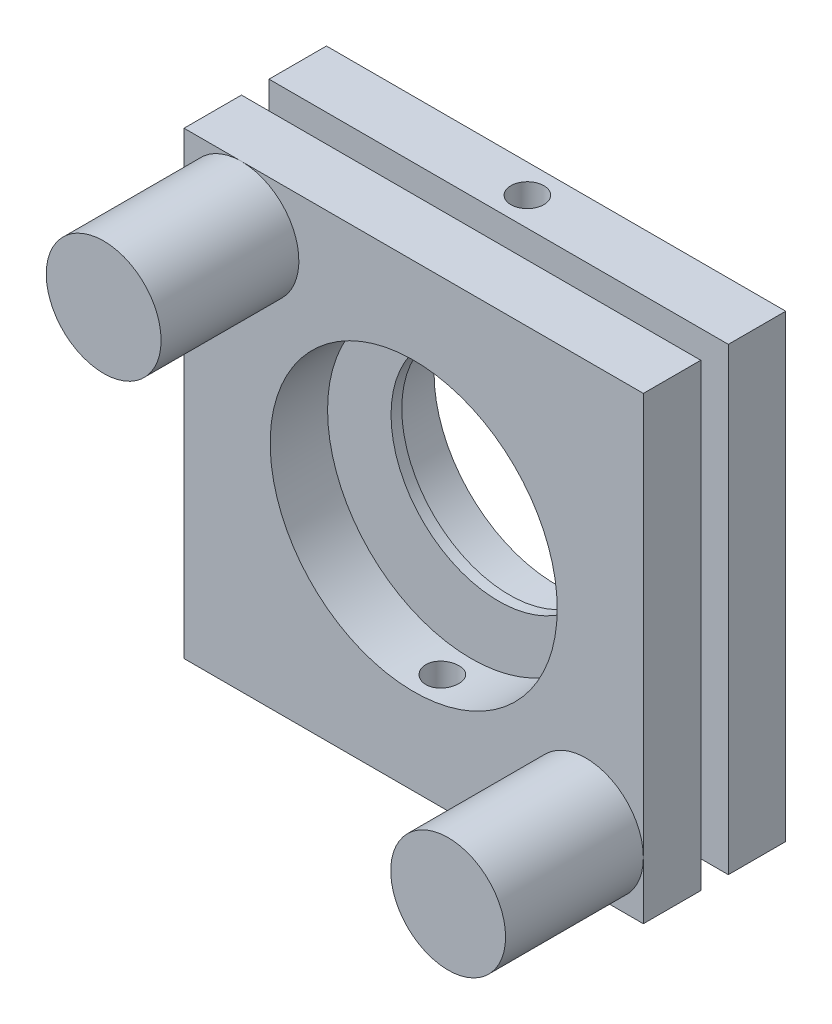
from build123d import *

# Parameters (mm, degrees)
SKETCH1_W               = 50.8
SKETCH1_H               = 50.8
SKETCH1_R               = 13.49375
BOSS_EXTRUDE1_DEPTH     = 6.35
LPATTERN2_COUNT         = 2
LPATTERN2_PITCH         = 9.398
SKETCH2_W               = 50.8
SKETCH2_H               = 50.8
SKETCH2_R               = 11.90625
BOSS_EXTRUDE2_DEPTH     = 1.190625
SKETCH3_R               = 1.82499
CUT_EXTRUDE1_DEPTH      = 19.05
SKETCH5_R               = 15.875
CUT_EXTRUDE2_DEPTH      = 6.35
CUT_EXTRUDE3_REACH      = 60.939
CUT_EXTRUDE3_END_RADIUS = 15.875
SKETCH6_R               = 1.82499
SKETCH7_R               = 6.35
BOSS_EXTRUDE3_DEPTH     = 15.24
SKETCH8_R               = 3.175
BOSS_EXTRUDE4_DEPTH     = 9.398


with BuildPart() as part:
    # Sketch1 → Boss-Extrude1 (new body)
    with BuildSketch(Plane.XY):
        Rectangle(SKETCH1_W, SKETCH1_H)
        Circle(SKETCH1_R, mode=Mode.SUBTRACT)
    extrude(amount=BOSS_EXTRUDE1_DEPTH)


with BuildPart() as lpattern2_1:
    # LPattern2: pattern copy
    add(part.part.moved(Location(Vector(0, 0, 1) * (1 * LPATTERN2_PITCH))))

    # Sketch5 → Cut-Extrude2 (cut)
    with BuildSketch(Plane.XY.offset(15.748)):
        Circle(SKETCH5_R)
    extrude(amount=-CUT_EXTRUDE2_DEPTH, mode=Mode.SUBTRACT)

    # Cut-Extrude3: up to this cylinder (the profile starts outside it)
    cut_extrude3_end = Plane(origin=(0, 0, 12.573), z_dir=(0, 0, 1)) * Cylinder(CUT_EXTRUDE3_END_RADIUS, 154.628, mode=Mode.PRIVATE)
    # Sketch6 → Cut-Extrude3 (cut, up to the surface)
    with BuildSketch(Plane.XZ.offset(25.4), mode=Mode.PRIVATE) as cut_extrude3_sk1:
        with Locations(Location((0, 12.573, 0), (0, 0, 270))):
            Circle(SKETCH6_R)
    cut_extrude3_tool1 = extrude(cut_extrude3_sk1.sketch, amount=-CUT_EXTRUDE3_REACH, mode=Mode.PRIVATE) - cut_extrude3_end
    add(cut_extrude3_tool1.solids().sort_by_distance((0, -25.4, 12.573))[0], mode=Mode.SUBTRACT)

    # Sketch7 → Boss-Extrude3 (add)
    with BuildSketch(Plane.XY.offset(15.748)):
        with Locations((19.05, -19.05)):
            Circle(SKETCH7_R)
        with Locations(Location((-19.05, 19.05, 0), (0, 0, 180))):
            Circle(SKETCH7_R)
    extrude(amount=BOSS_EXTRUDE3_DEPTH)


with BuildPart() as part_1:
    add(part.part)

    # Sketch2 → Boss-Extrude2 (add)
    with BuildSketch(Plane.XY.offset(6.35)):
        Rectangle(SKETCH2_W, SKETCH2_H)
        Circle(SKETCH2_R, mode=Mode.SUBTRACT)
    extrude(amount=-BOSS_EXTRUDE2_DEPTH)

    # Sketch3 → Cut-Extrude1 (cut)
    with BuildSketch(Plane(origin=(0, 25.4, 0), x_dir=(1, 0, 0), z_dir=(0, 1, 0))):
        with Locations(Location((0, -3.175, 0), (0, 0, 270))):
            Circle(SKETCH3_R)
    extrude(amount=-CUT_EXTRUDE1_DEPTH, mode=Mode.SUBTRACT)

    add(lpattern2_1.part)  # Boss-Extrude4 merges LPattern2_1
    # Sketch8 → Boss-Extrude4 (add)
    with BuildSketch(Plane(origin=(0, 0, 9.398), x_dir=(-1, 0, 0), z_dir=(0, 0, -1))):
        with Locations((-19.05, -19.05)):
            Circle(SKETCH8_R)
        with Locations((19.05, 19.05)):
            Circle(SKETCH8_R)
    extrude(amount=BOSS_EXTRUDE4_DEPTH)


solid = part_1.part
